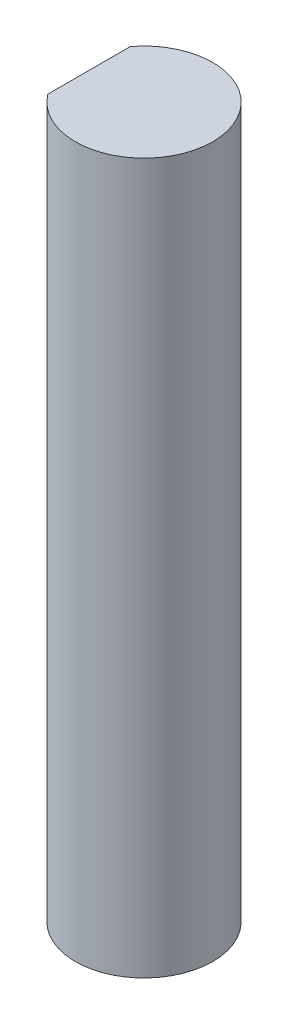
from build123d import *

# Parameters (mm, degrees)
BOSS_EXTRUDE1_DEPTH = 31


with BuildPart() as part:
    # Sketch2 → Boss-Extrude1 (new body)
    with BuildSketch(Plane(origin=(0, 0, 0), x_dir=(1, 0, 0), z_dir=(0, 1, 0))):
        with BuildLine():
            Line((-2.4, 1.8), (-2.4, -1.8))
            ThreePointArc((-2.4, -1.8), (3, 0), (-2.4, 1.8))
        make_face()
    extrude(amount=BOSS_EXTRUDE1_DEPTH)


solid = part.part
